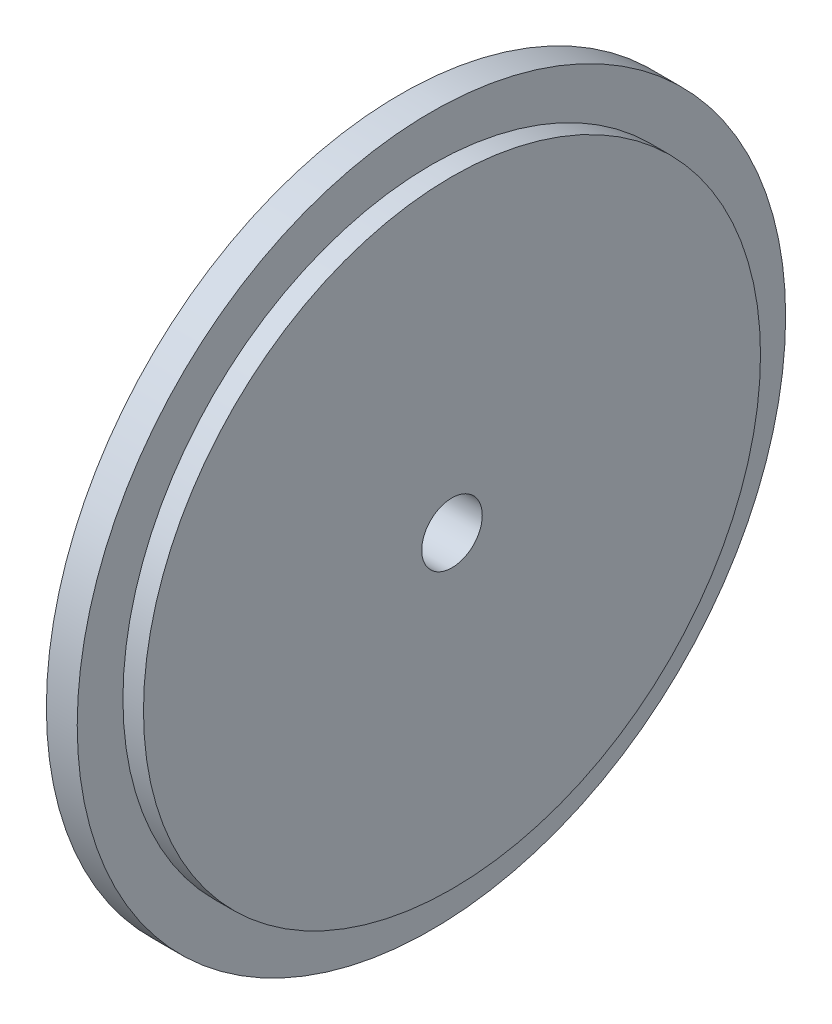
from build123d import *

# Parameters (mm, degrees)
SKETCH1_R           = 31
SKETCH1_R_2         = 2.65
BOSS_EXTRUDE1_DEPTH = 4.5
SKETCH2_R           = 50
SKETCH2_R_2         = 27
CUT_EXTRUDE1_DEPTH  = 1.8


with BuildPart() as part:
    # Sketch1 → Boss-Extrude1 (new body)
    with BuildSketch(Plane(origin=(0, 0, 0), x_dir=(0, 0, -1), z_dir=(1, 0, 0))):
        Circle(SKETCH1_R)
        Circle(SKETCH1_R_2, mode=Mode.SUBTRACT)
    extrude(amount=BOSS_EXTRUDE1_DEPTH)

    # Sketch2 → Cut-Extrude1 (cut)
    with BuildSketch(Plane(origin=(4.5, 0, 0), x_dir=(0, 0, -1), z_dir=(1, 0, 0))):
        Circle(SKETCH2_R)
        Circle(SKETCH2_R_2, mode=Mode.SUBTRACT)
    extrude(amount=-CUT_EXTRUDE1_DEPTH, mode=Mode.SUBTRACT)


solid = part.part
